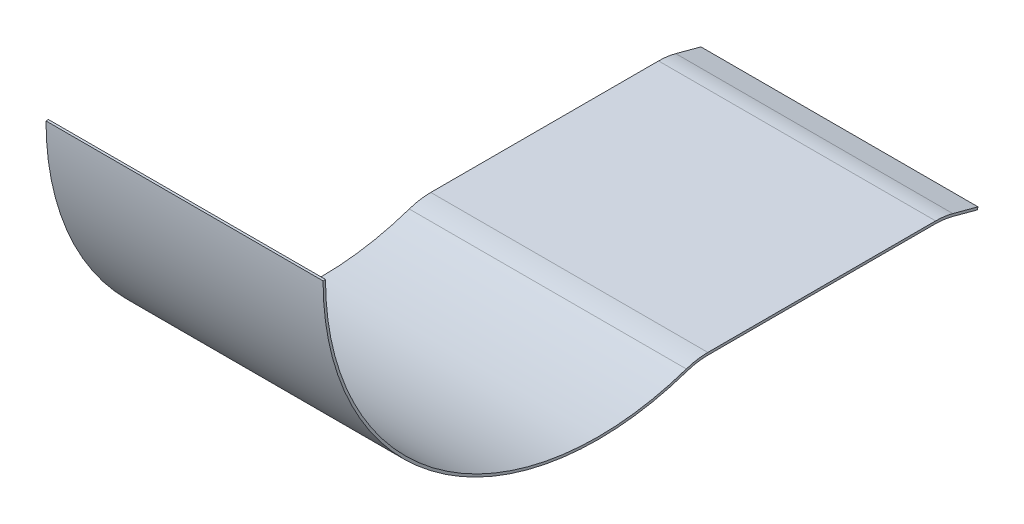
from build123d import *

# Parameters (mm, degrees)
EXTRUDE_THIN1_DEPTH = 134.9375


with BuildPart() as part:
    # Sketch1 → Extrude-Thin1 (new, symmetric)
    with BuildSketch(Plane(origin=(0, 0, 0), x_dir=(0, 0, -1), z_dir=(1, 0, 0))):
        with BuildLine():
            ThreePointArc((24.209375, 95.25), (136.32181049, -122.691603728), (378.820833581, -158.215745192))
            ThreePointArc((378.820833581, -158.215745192), (388.767577151, -155.705127985), (398.991457096, -154.860625))
            Line((398.991457096, -154.860625), (620.869080778, -154.860625))
            ThreePointArc((620.869080778, -154.860625), (629.002086236, -155.393690341), (636.995933716, -156.983765468))
            Line((636.995933716, -156.983765468), (661.530449704, -163.557769213))
            Line((661.530449704, -163.557769213), (662.146762555, -161.257658339))
            Line((662.146762555, -161.257658339), (637.612246567, -154.683654594))
            ThreePointArc((637.612246567, -154.683654594), (629.312901731, -153.032812265), (620.869080778, -152.479375))
            Line((620.869080778, -152.479375), (398.991457096, -152.479375))
            ThreePointArc((398.991457096, -152.479375), (388.376855625, -153.356151985), (378.049981727, -155.962716346))
            ThreePointArc((378.049981727, -155.962716346), (137.706505507, -120.754345029), (26.590625, 95.25))
            Line((26.590625, 95.25), (24.209375, 95.25))
        make_face()
    extrude(amount=EXTRUDE_THIN1_DEPTH, both=True)


solid = part.part
